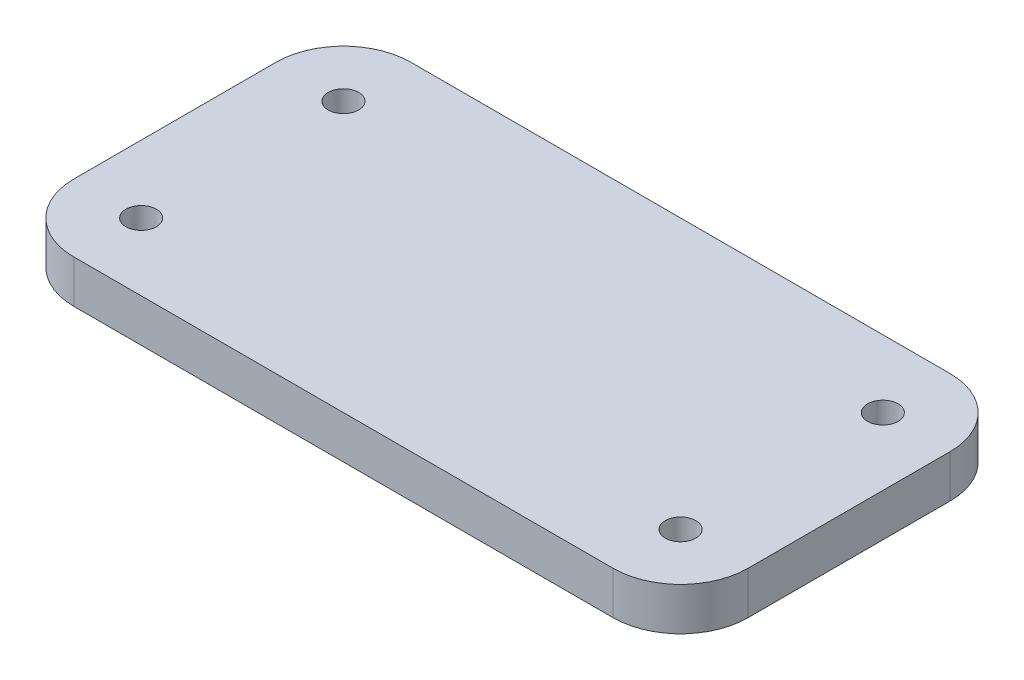
from build123d import *

# Parameters (mm, degrees)
SKETCH1_W                       = 50
SKETCH1_H                       = 25
SKETCH1_R                       = 1.13
BOSS_EXTRUDE1_DEPTH             = 3.175
FILLET1_R                       = 5
F_4_40_TAPPED_HOLE1_D           = 2.2606
F_4_40_TAPPED_HOLE1_ON_FACE_2_D = 2.2606


with BuildPart() as part:
    # Sketch1 → Boss-Extrude1 (new body)
    with BuildSketch(Plane(origin=(0, 0, 0), x_dir=(1, 0, 0), z_dir=(0, 1, 0))):
        with Locations((25, -12.5)):
            Rectangle(SKETCH1_W, SKETCH1_H)
        with Locations(Location((5, -5, 0), (0, 0, 270))):
            Circle(SKETCH1_R, mode=Mode.SUBTRACT)
        with Locations(Location((45, -5, 0), (0, 0, 270))):
            Circle(SKETCH1_R, mode=Mode.SUBTRACT)
        with Locations(Location((45, -20, 0), (0, 0, 270))):
            Circle(SKETCH1_R, mode=Mode.SUBTRACT)
        with Locations(Location((5, -20, 0), (0, 0, 270))):
            Circle(SKETCH1_R, mode=Mode.SUBTRACT)
    extrude(amount=BOSS_EXTRUDE1_DEPTH)

    # Fillet1
    fillet1_edges = [part.edges().sort_by_distance(p)[0] for p in [
        (0, 1.5875, 0),
        (50, 1.5875, 0),
        (50, 1.5875, 25),
        (0, 1.5875, 25),
    ]]
    fillet(fillet1_edges, radius=FILLET1_R)

    # #4-40 Tapped Hole1 (through all)
    with Locations(Plane(origin=(5, 3.175, 5), x_dir=(0, 0, 1), z_dir=(0, 1, 0))):
        with Locations((0, 0), (0, 40), (15, 40)):
            Hole(F_4_40_TAPPED_HOLE1_D / 2)

    # #4-40 Tapped Hole1 on face 2 (through all)
    with Locations(Plane(origin=(5, 0, 20), x_dir=(0, 0, 1), z_dir=(0, 1, 0))):
        with Locations((0, 0)):
            Hole(F_4_40_TAPPED_HOLE1_ON_FACE_2_D / 2)


solid = part.part
